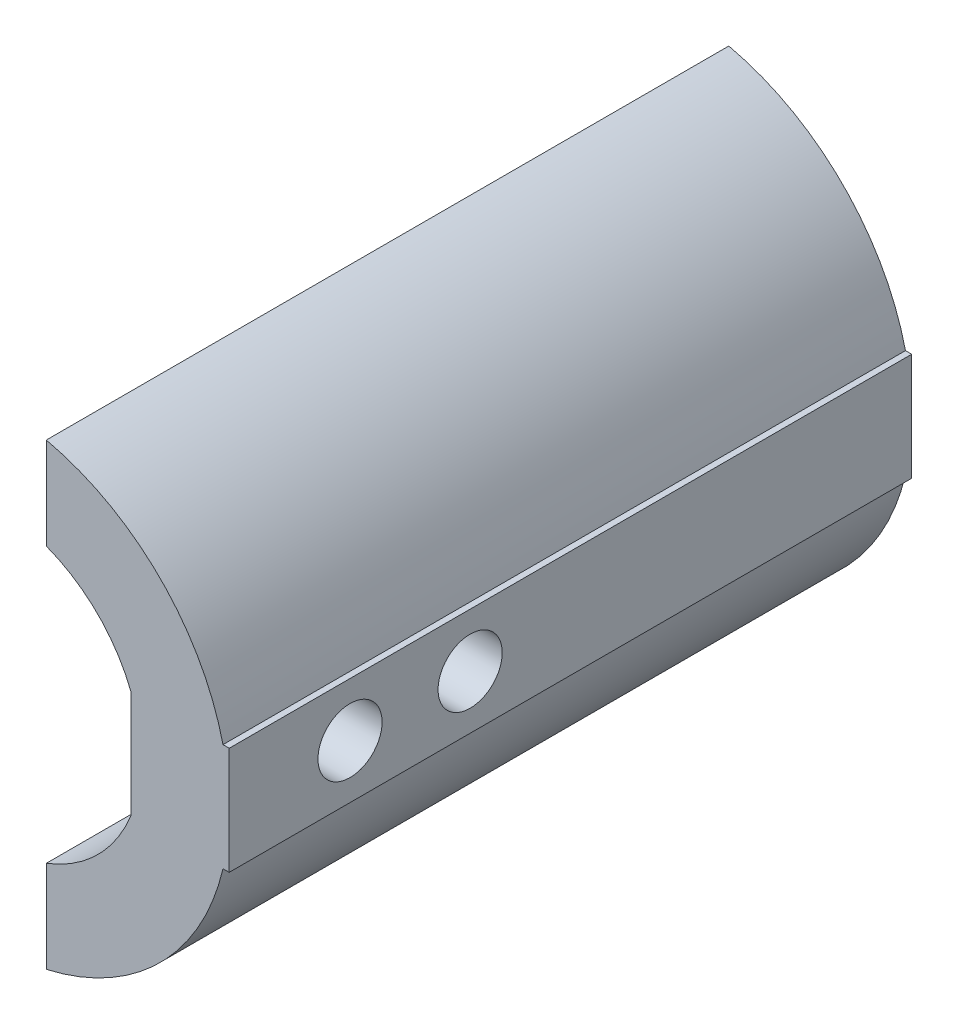
from build123d import *

# Parameters (mm, degrees)
BOSS_EXTRUDE1_DEPTH = 25.4
SKETCH2_W           = 27.340735927
SKETCH2_H           = 19.391580929
CUT_EXTRUDE1_DEPTH  = 50
SKETCH4_R           = 1.1938
CUT_EXTRUDE2_DEPTH  = 50


with BuildPart() as part:
    # Sketch1 → Boss-Extrude1 (new body)
    with BuildSketch(Plane.XY):
        with BuildLine():
            Line((-8.516561995, -2.000000064), (-8.748247165, -2.000000064))
            Line((-8.748247165, -2.000000064), (-8.748247165, 2))
            Line((-8.748247165, 2), (-8.51656201, 2))
            ThreePointArc((-8.51656201, 2), (0, 8.748247165), (8.51656201, 2))
            Line((8.51656201, 2), (8.748247165, 2))
            Line((8.748247165, 2), (8.748247165, -2.000000064))
            Line((8.748247165, -2.000000064), (8.516561995, -2.000000064))
            ThreePointArc((8.516561995, -2.000000064), (0, -8.748247165), (-8.516561995, -2.000000064))
        make_face()
        with BuildLine():
            Line((-5.088737122, 2), (-5.088737097, -2.000000064))
            ThreePointArc((-5.088737097, -2.000000064), (0, -5.467654478), (5.088737097, -2.000000064))
            Line((5.088737097, -2.000000064), (5.088737122, 2))
            ThreePointArc((5.088737122, 2), (0, 5.467654478), (-5.088737122, 2))
        make_face(mode=Mode.SUBTRACT)
    extrude(amount=-BOSS_EXTRUDE1_DEPTH)

    # Sketch2 → Cut-Extrude1 (cut)
    with BuildSketch(Plane.XY):
        with Locations((-11.729632037, -0.299788476)):
            Rectangle(SKETCH2_W, SKETCH2_H)
    extrude(amount=-CUT_EXTRUDE1_DEPTH, mode=Mode.SUBTRACT)

    # Sketch4 → Cut-Extrude2 (cut)
    with BuildSketch(Plane(origin=(11.288247165, 0, 0), x_dir=(0, 0, -1), z_dir=(1, 0, 0))):
        with Locations((4.4958, 0)):
            Circle(SKETCH4_R)
        with Locations((8.9662, 0)):
            Circle(SKETCH4_R)
    extrude(amount=-CUT_EXTRUDE2_DEPTH, mode=Mode.SUBTRACT)


solid = part.part
